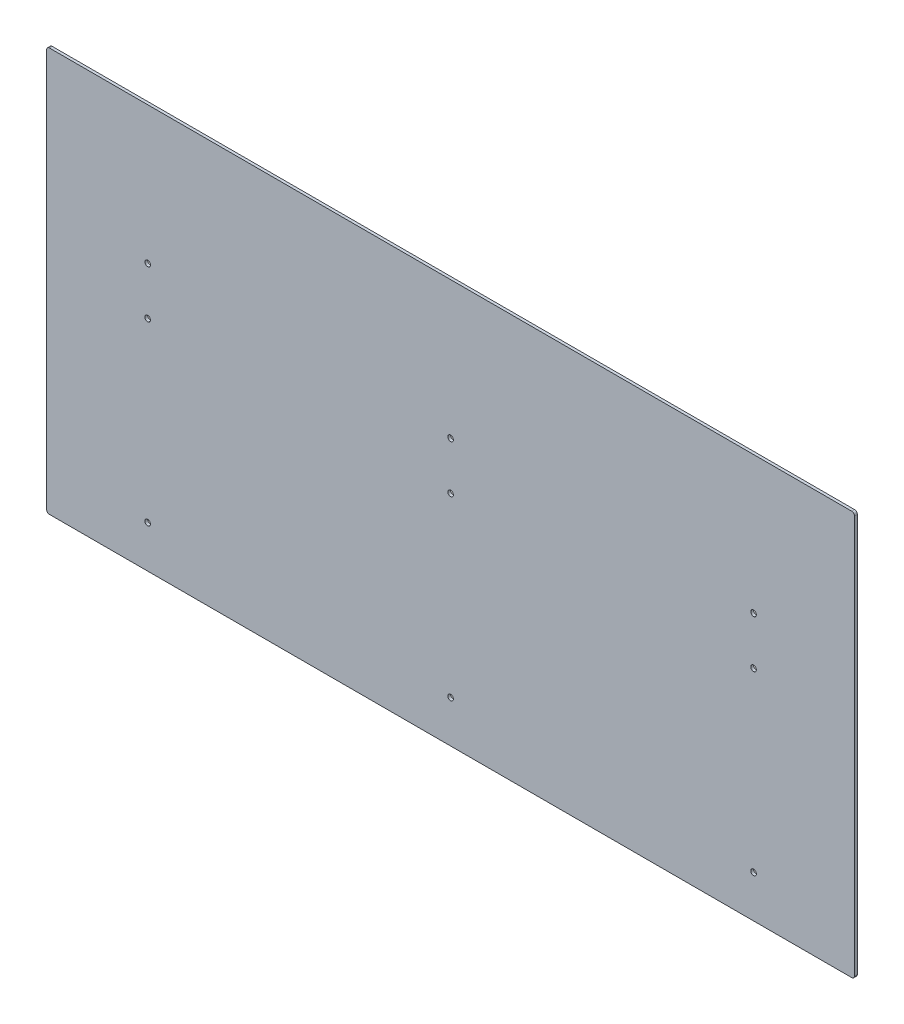
from build123d import *

# Parameters (mm, degrees)
SKETCH1_W                   = 914.4
SKETCH1_H                   = 457.2
BOSS_EXTRUDE1_DEPTH         = 3.175
F_1_4_0_25_DIAMETER_HOLE1_D = 6.35
FILLET1_R                   = 3.175


with BuildPart() as part:
    # Sketch1 → Boss-Extrude1 (new body)
    with BuildSketch(Plane.XY):
        with Locations((457.2, 228.6)):
            Rectangle(SKETCH1_W, SKETCH1_H)
    extrude(amount=BOSS_EXTRUDE1_DEPTH)

    # 1/4 (0.25) Diameter Hole1 (through all)
    with Locations(Plane.XY.offset(3.175)):
        with Locations((114.3, 247.65), (114.3, 301.625), (457.2, 301.625), (457.2, 247.65), (800.1, 247.65), (800.1, 301.625), (114.3, 47.625), (457.2, 47.625), (800.1, 47.625)):
            Hole(F_1_4_0_25_DIAMETER_HOLE1_D / 2)

    # Fillet1
    fillet1_edges = [part.edges().sort_by_distance(p)[0] for p in [
        (0, 457.2, 1.5875),
        (914.4, 457.2, 1.5875),
        (914.4, 0, 1.5875),
        (0, 0, 1.5875),
    ]]
    fillet(fillet1_edges, radius=FILLET1_R)


solid = part.part
